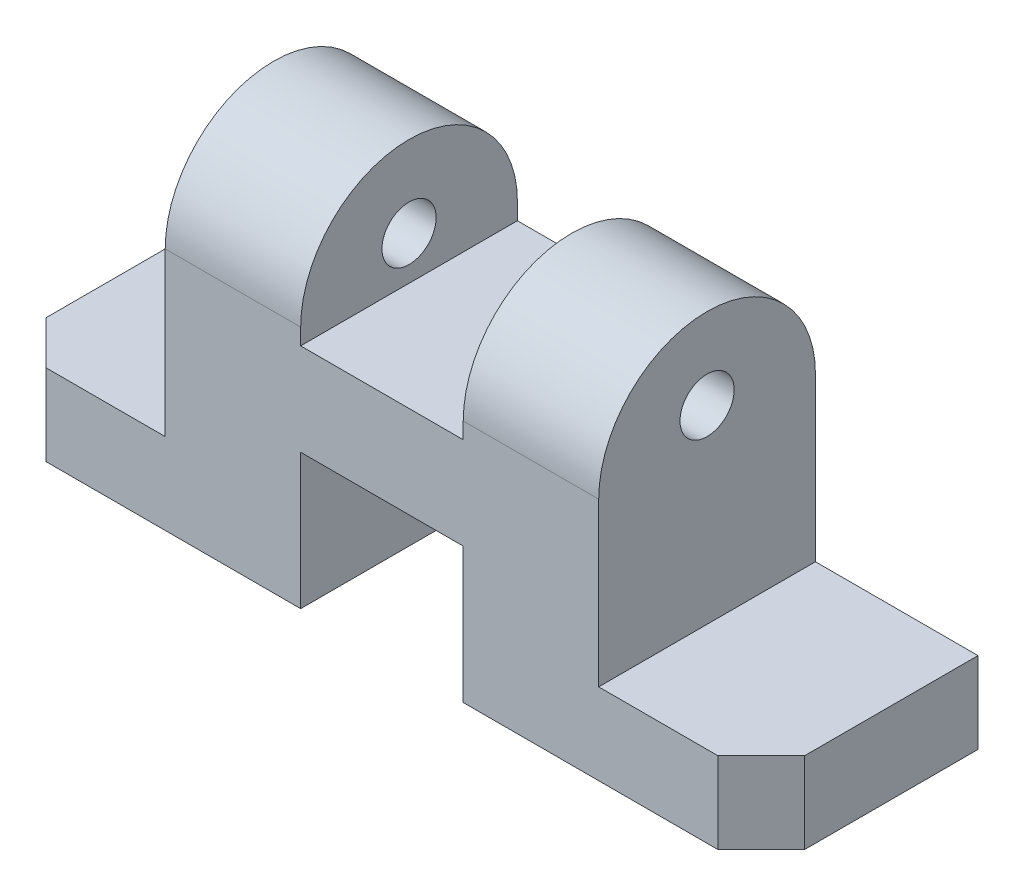
from build123d import *

# Parameters (mm, degrees)
BOSS_EXTRUDE1_DEPTH = 20
CUT_EXTRUDE1_DEPTH  = 130.325171564
HOLE1_D             = 10
CHAMFER1_SIZE       = 8


with BuildPart() as part:
    # Sketch1 → Boss-Extrude1 (new, symmetric)
    with BuildSketch(Plane.XY):
        Polygon((-70, 0), (-70, 15), (-40, 15), (-40, 65), (-15, 65), (-15, 42), (15, 42), (15, 65), (40, 65), (40, 15), (70, 15), (70, 0), (15, 0), (15, 25), (-15, 25), (-15, 0), align=None)
    extrude(amount=BOSS_EXTRUDE1_DEPTH, both=True)

    # Sketch2 → Cut-Extrude1 (cut, through all)
    with BuildSketch(Plane.ZY.offset(40)):
        with BuildLine():
            Line((-20, 65), (-20, 45))
            ThreePointArc((-20, 45), (-14.142135624, 59.142135624), (0, 65))
            Line((0, 65), (-20, 65))
        make_face()
    cut_extrude1 = extrude(amount=-CUT_EXTRUDE1_DEPTH, mode=Mode.SUBTRACT)

    # Mirror1: Cut-Extrude1 across plane
    add(cut_extrude1.mirror(Plane.XY), mode=Mode.SUBTRACT)

    # Hole1 (through all)
    with Locations(Plane(origin=(40, 0, 0), x_dir=(0, 0, -1), z_dir=(1, 0, 0))):
        with Locations((0, 50)):
            Hole(HOLE1_D / 2)

    # Chamfer1
    chamfer1_edges = [part.edges().sort_by_distance(p)[0] for p in [
        (70, 7.5, 20),
        (-70, 7.5, 20),
    ]]
    chamfer(chamfer1_edges, length=CHAMFER1_SIZE)


solid = part.part
